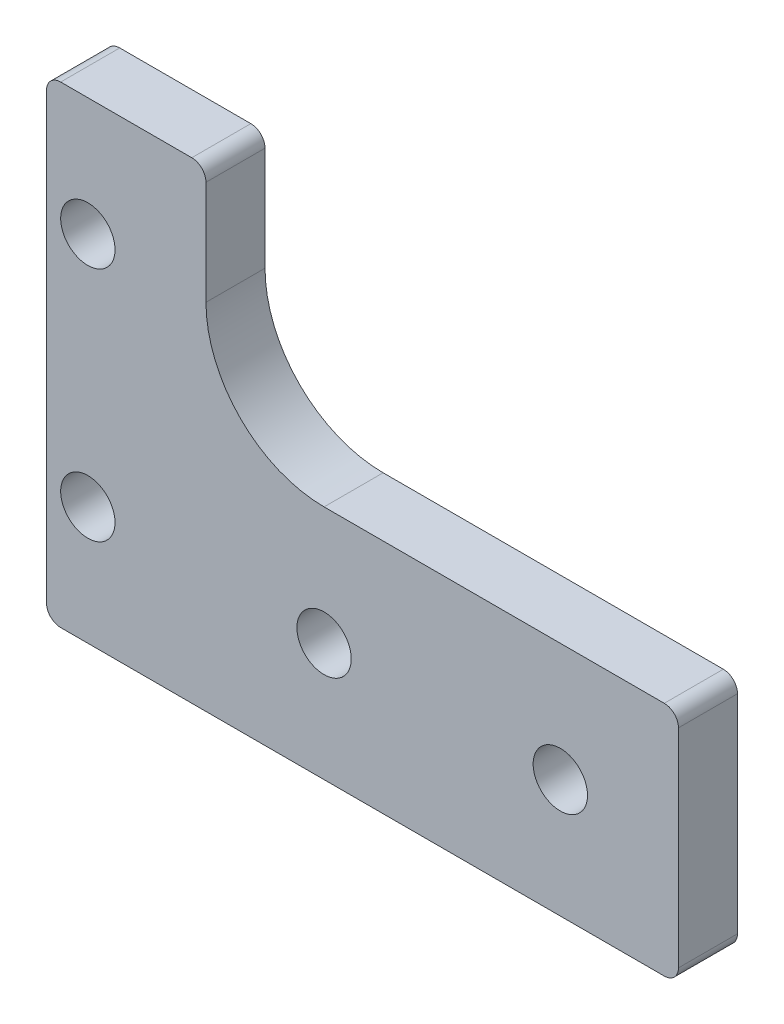
from build123d import *

# Parameters (mm, degrees)
BOSS_EXTRUDE1_DEPTH = 6.35
SKETCH2_R           = 2.921
CUT_EXTRUDE1_DEPTH  = 92.800885072
SKETCH3_W           = 8.255
SKETCH3_H           = 50.8
CUT_EXTRUDE2_DEPTH  = 92.800885072
FILLET1_R           = 12.7
FILLET2_R           = 1.524


with BuildPart() as part:
    # Sketch1 → Boss-Extrude1 (new body)
    with BuildSketch(Plane.XY):
        Polygon((0, 0), (0, 50.8), (25.4, 50.8), (25.4, 25.4), (76.2, 25.4), (76.2, 0), align=None)
    extrude(amount=BOSS_EXTRUDE1_DEPTH)

    # Sketch2 → Cut-Extrude1 (cut, through all)
    with BuildSketch(Plane.XY.offset(6.35)):
        with Locations((12.7, 38.1)):
            Circle(SKETCH2_R)
        with Locations((12.7, 12.7)):
            Circle(SKETCH2_R)
        with Locations((38.1, 12.7)):
            Circle(SKETCH2_R)
        with Locations((63.5, 12.7)):
            Circle(SKETCH2_R)
    extrude(amount=-CUT_EXTRUDE1_DEPTH, mode=Mode.SUBTRACT)

    # Sketch3 → Cut-Extrude2 (cut, through all)
    with BuildSketch(Plane.XY.offset(6.35)):
        with Locations((4.1275, 25.4)):
            Rectangle(SKETCH3_W, SKETCH3_H)
    extrude(amount=-CUT_EXTRUDE2_DEPTH, mode=Mode.SUBTRACT)

    # Fillet1
    fillet1_edges = [part.edges().sort_by_distance(p)[0] for p in [
        (25.4, 25.4, 3.175),
    ]]
    fillet(fillet1_edges, radius=FILLET1_R)

    # Fillet2
    fillet2_edges = [part.edges().sort_by_distance(p)[0] for p in [
        (25.4, 50.8, 3.175),
        (76.2, 25.4, 3.175),
        (76.2, 0, 3.175),
        (8.255, 50.8, 3.175),
        (8.255, 0, 3.175),
    ]]
    fillet(fillet2_edges, radius=FILLET2_R)


solid = part.part
